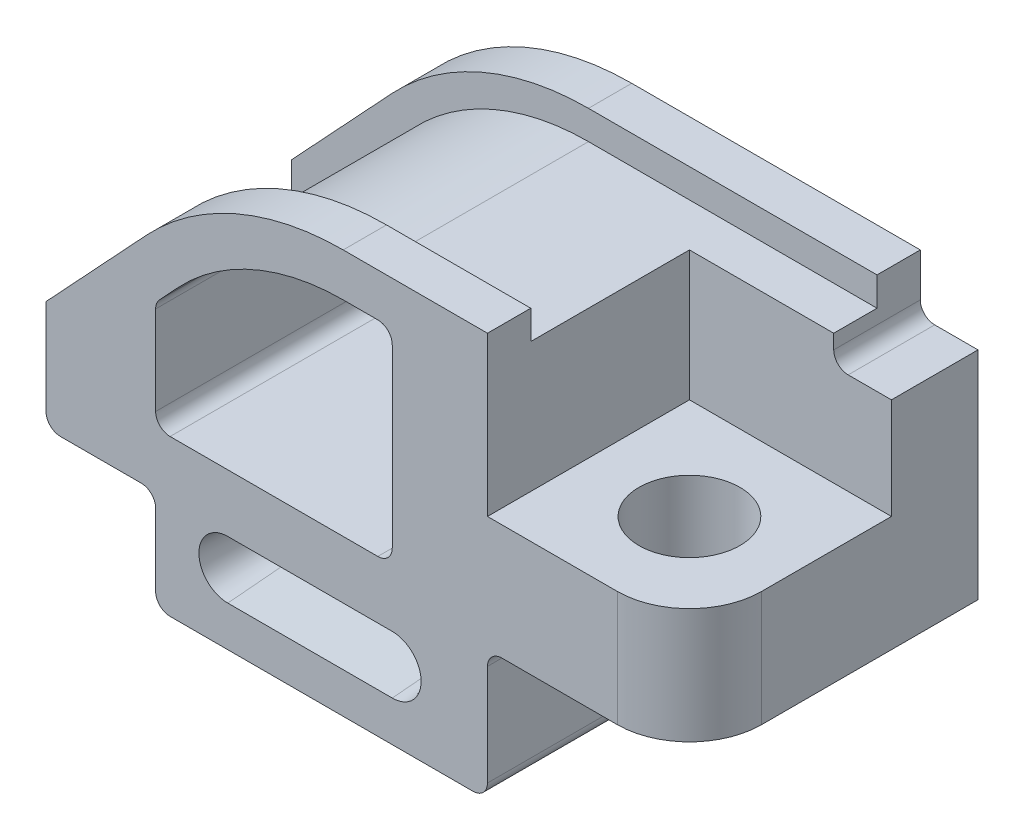
from build123d import *

# Parameters (mm, degrees)
BOSS_EXTRUDE1_DEPTH     = 50
CUT_EXTRUDE1_DEPTH      = 231.236834586
CUT_EXTRUDE1_DEPTH_BACK = 85
SKETCH3_W               = 70
SKETCH3_H               = 70
CUT_EXTRUDE2_DEPTH      = 55
SKETCH4_R               = 17.5
CUT_EXTRUDE3_DEPTH      = 183.027470454
CUT_EXTRUDE4_DEPTH      = 35
FILLET1_R               = 5
FILLET2_R               = 5
CUT_EXTRUDE5_DEPTH      = 25
CUT_EXTRUDE5_DRAFT      = -5
MIRROR1_COPY_1_DEPTH    = 25
MIRROR1_COPY_1_DRAFT    = -5


with BuildPart() as part:
    # Sketch1 → Boss-Extrude1 (new, symmetric)
    with BuildSketch(Plane.XY):
        with BuildLine():
            Line((0, 0), (-115, 0))
            Line((-115, 0), (-115, 35))
            Line((-115, 35), (-153, 35))
            Line((-153, 35), (-153, 73))
            Line((-153, 73), (-118.15707843, 110.364458857))
            ThreePointArc((-118.15707843, 110.364458857), (-87.160639926, 132.270575779), (-50, 140))
            Line((-50, 140), (50, 140))
            Line((50, 140), (50, 120))
            Line((50, 120), (70, 120))
            Line((70, 120), (70, 45))
            Line((70, 45), (0, 45))
            Line((0, 45), (0, 0))
        make_face()
    extrude(amount=BOSS_EXTRUDE1_DEPTH, both=True)

    # Sketch2 → Cut-Extrude1 (cut, two sides: drawn at the far end of the back side and taken through both)
    with BuildSketch(Plane.XY.offset(50).offset(-CUT_EXTRUDE1_DEPTH_BACK)):
        with BuildLine():
            Line((-33, 54), (-33, 125))
            Line((-33, 125), (-50, 125))
            ThreePointArc((-50, 125), (-81.179403892, 118.514674664), (-107.186772906, 100.134483456))
            Line((-107.186772906, 100.134483456), (-115, 91.755823196))
            Line((-115, 91.755823196), (-115, 54))
            Line((-115, 54), (-33, 54))
        make_face()
    extrude(amount=CUT_EXTRUDE1_DEPTH + CUT_EXTRUDE1_DEPTH_BACK, mode=Mode.SUBTRACT)

    # Sketch3 → Cut-Extrude2 (cut)
    with BuildSketch(Plane(origin=(0, 140, 0), x_dir=(1, 0, 0), z_dir=(0, 1, 0))):
        with Locations((35, -15)):
            Rectangle(SKETCH3_W, SKETCH3_H)
    extrude(amount=-CUT_EXTRUDE2_DEPTH, mode=Mode.SUBTRACT)

    # Sketch4 → Cut-Extrude3 (cut, through all)
    with BuildSketch(Plane(origin=(0, 85, 0), x_dir=(1, 0, 0), z_dir=(0, 1, 0))):
        with Locations(Location((35, -15, 0), (0, 0, 180))):
            Circle(SKETCH4_R)
        with BuildLine():
            Line((70, -25), (70, -50))
            Line((70, -50), (45, -50))
            ThreePointArc((45, -50), (62.67766953, -42.67766953), (70, -25))
        make_face()
    extrude(amount=-CUT_EXTRUDE3_DEPTH, mode=Mode.SUBTRACT)

    # Sketch5 → Cut-Extrude4 (cut, symmetric)
    with BuildSketch(Plane.XY):
        with BuildLine():
            Line((-110.843541414, 103.544475257), (-153, 58.337208144))
            Line((-153, 58.337208144), (-153, 73))
            Line((-153, 73), (-118.15707843, 110.364458857))
            ThreePointArc((-118.15707843, 110.364458857), (-87.160639926, 132.270575779), (-50, 140))
            Line((-50, 140), (0, 140))
            Line((0, 140), (50, 140))
            Line((50, 140), (50, 130))
            Line((50, 130), (0, 130))
            Line((0, 130), (-50, 130))
            ThreePointArc((-50, 130), (-83.173149237, 123.099975036), (-110.843541414, 103.544475257))
        make_face()
    extrude(amount=CUT_EXTRUDE4_DEPTH, both=True, mode=Mode.SUBTRACT)

    # Fillet1
    fillet1_edges = [part.edges().sort_by_distance(p)[0] for p in [
        (-115, 91.755823196, 7.5),
        (-33, 125, 7.5),
        (-33, 54, 7.5),
        (-115, 54, 7.5),
    ]]
    fillet(fillet1_edges, radius=FILLET1_R)

    # Fillet2
    fillet2_edges = [part.edges().sort_by_distance(p)[0] for p in [
        (0, 0, 0),
        (-115, 0, 0),
        (-115, 35, 0),
        (-153, 35, 0),
        (0, 45, 0),
        (50, 120, -35),
    ]]
    fillet(fillet2_edges, radius=FILLET2_R)


with BuildPart() as cut_extrude5_tool:
    # Sketch6 → Cut-Extrude5 (with draft: the straight prism first)
    with BuildSketch(Plane.XY.offset(50)):
        with BuildLine():
            ThreePointArc((-90, 34), (-100, 24), (-90, 14))
            Line((-90, 14), (-33, 14))
            ThreePointArc((-33, 14), (-23, 24), (-33, 34))
            Line((-33, 34), (-90, 34))
        make_face()
    extrude(amount=-CUT_EXTRUDE5_DEPTH)
    # Cut-Extrude5: the draft: its side faces are tilted about the plane it starts from
    cut_extrude5_sides = [cut_extrude5_tool.faces().sort_by_distance(p)[0] for p in [
        (-23, 24, 37.5),
        (-61.5, 34, 37.5),
        (-100, 24, 37.5),
        (-61.5, 14, 37.5),
    ]]
    draft(cut_extrude5_sides, Plane.XY.offset(50), CUT_EXTRUDE5_DRAFT)


with BuildPart() as part_1:
    add(part.part)

    # Cut-Extrude5: cut by cut_extrude5_tool
    add(cut_extrude5_tool.part, mode=Mode.SUBTRACT)


with BuildPart() as mirror1_copy_1_tool:
    # Mirror1 copy 1 sketch → Mirror1 copy 1 (with draft: the straight prism first)
    with BuildSketch(Plane(origin=(0, 0, -50), x_dir=(1, 0, 0), z_dir=(0, 0, -1))):
        with BuildLine():
            ThreePointArc((-90, -34), (-100, -24), (-90, -14))
            Line((-90, -14), (-33, -14))
            ThreePointArc((-33, -14), (-23, -24), (-33, -34))
            Line((-33, -34), (-90, -34))
        make_face()
    extrude(amount=-MIRROR1_COPY_1_DEPTH)
    # Mirror1 copy 1: the draft: its side faces are tilted about the plane it starts from
    mirror1_copy_1_sides = [mirror1_copy_1_tool.faces().sort_by_distance(p)[0] for p in [
        (-23, 24, -37.5),
        (-61.5, 34, -37.5),
        (-100, 24, -37.5),
        (-61.5, 14, -37.5),
    ]]
    draft(mirror1_copy_1_sides, Plane(origin=(0, 0, -50), x_dir=(1, 0, 0), z_dir=(0, 0, -1)), MIRROR1_COPY_1_DRAFT)


with BuildPart() as part_2:
    add(part_1.part)

    # Mirror1 copy 1: cut by mirror1_copy_1_tool
    add(mirror1_copy_1_tool.part, mode=Mode.SUBTRACT)


solid = part_2.part
